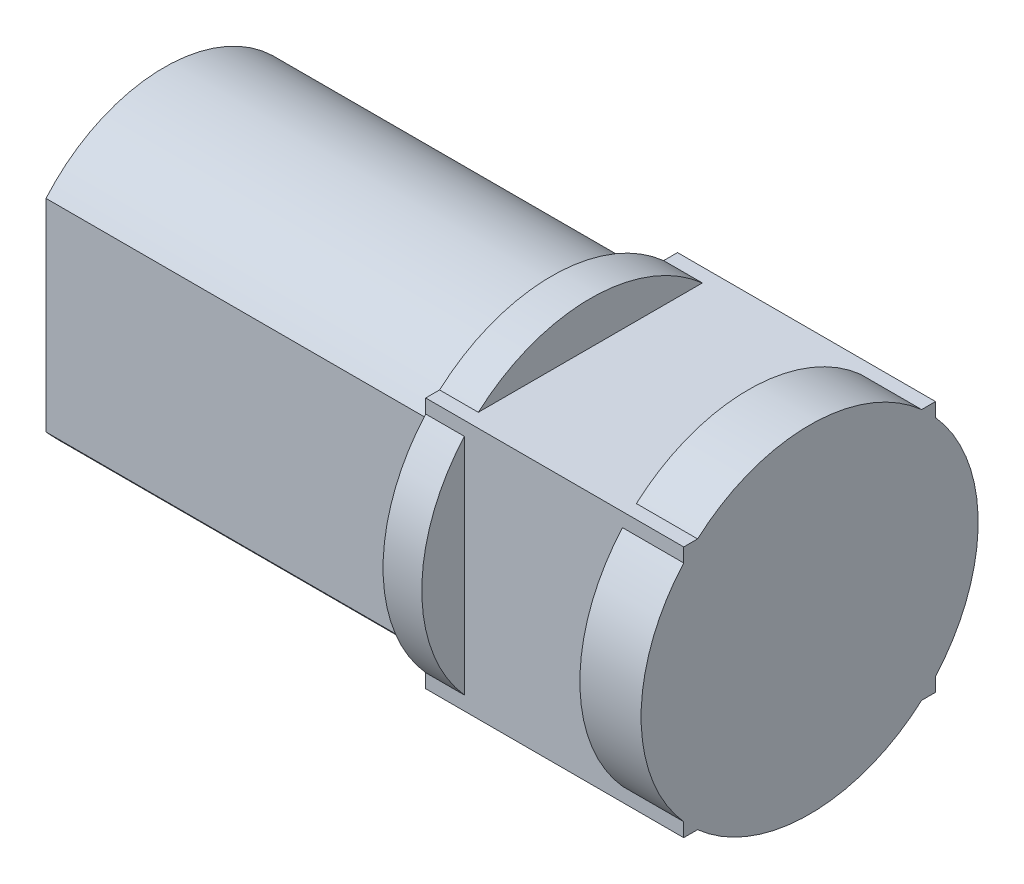
from build123d import *

# Parameters (mm, degrees)
SKETCH1_W           = 16.51
SKETCH1_H           = 16.51
BOSS_EXTRUDE1_DEPTH = 8.4582
SKETCH2_R           = 11.049
BOSS_EXTRUDE2_DEPTH = 4.0132
BOSS_EXTRUDE3_START = -2.54
SKETCH3_R           = 11.049
BOSS_EXTRUDE3_DEPTH = 2.54
BOSS_EXTRUDE4_DEPTH = 25.4


with BuildPart() as part:
    # Sketch1 → Boss-Extrude1 (new, symmetric)
    with BuildSketch(Plane(origin=(0, 0, 0), x_dir=(0, 0, -1), z_dir=(1, 0, 0))):
        Rectangle(SKETCH1_W, SKETCH1_H)
    extrude(amount=BOSS_EXTRUDE1_DEPTH, both=True)

    # Sketch2 → Boss-Extrude2 (add)
    with BuildSketch(Plane(origin=(8.4582, 0, 0), x_dir=(0, 0, -1), z_dir=(1, 0, 0))):
        Circle(SKETCH2_R)
    extrude(amount=-BOSS_EXTRUDE2_DEPTH)

    # Sketch3 → Boss-Extrude3 (add)
    with BuildSketch(Plane.ZY.offset(8.4582).offset(BOSS_EXTRUDE3_START)):
        Circle(SKETCH3_R)
    extrude(amount=BOSS_EXTRUDE3_DEPTH)

    # Sketch4 → Boss-Extrude4 (add)
    with BuildSketch(Plane.ZY.offset(8.4582)):
        with BuildLine():
            Line((-7.747, -6.632136504), (-7.747, 6.632136504))
            ThreePointArc((-7.747, 6.632136504), (0, 10.1981), (7.747, 6.632136504))
            Line((7.747, 6.632136504), (7.747, -6.632136504))
            ThreePointArc((7.747, -6.632136504), (0, -10.1981), (-7.747, -6.632136504))
        make_face()
    extrude(amount=BOSS_EXTRUDE4_DEPTH)


solid = part.part
